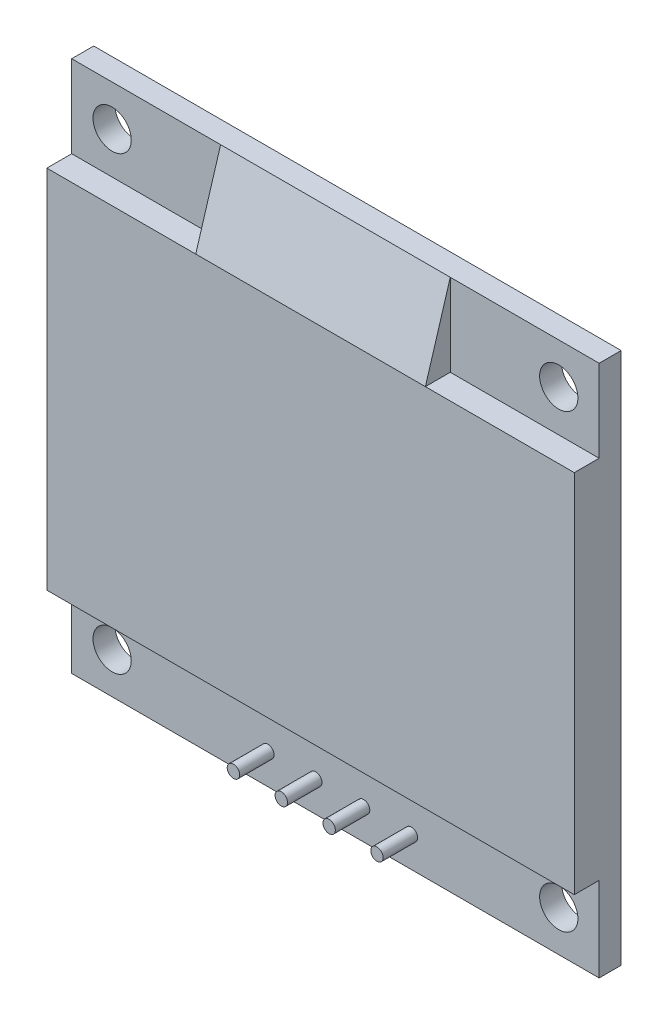
from build123d import *

# Parameters (mm, degrees)
ESQUISSE1_W                = 27.56
ESQUISSE1_H                = 27.82
ESQUISSE1_R                = 1
BOSS_EXTRU_1_DEPTH         = 1.15
ESQUISSE3_W                = 27.56
ESQUISSE3_H                = 19.1
BOSS_EXTRU_2_DEPTH         = 1.3
BOSS_EXTRU_3_START         = -10.1
ESQUISSE4_R                = 0.325
BOSS_EXTRU_3_DEPTH         = 11.9
R_P_TITION_LIN_AIRE1_COUNT = 4
R_P_TITION_LIN_AIRE1_PITCH = 2.5
ESQUISSE5_W                = 6.517687079
ESQUISSE5_H                = 1.70105674
BOSS_EXTRU_4_DEPTH         = 0.5
ESQUISSE6_W                = 10
ESQUISSE6_H                = 2.5
BOSS_EXTRU_5_DEPTH         = 2.3
BOSS_EXTRU_6_DEPTH         = 6


with BuildPart() as part:
    # Esquisse1 → Boss.-Extru.1 (new body)
    with BuildSketch(Plane.XY):
        Rectangle(ESQUISSE1_W, ESQUISSE1_H)
        with Locations((-11.668662175, 11.778743894)):
            Circle(ESQUISSE1_R, mode=Mode.SUBTRACT)
        with Locations((11.668662175, 11.778743894)):
            Circle(ESQUISSE1_R, mode=Mode.SUBTRACT)
        with Locations((-11.668662175, -11.778743894)):
            Circle(ESQUISSE1_R, mode=Mode.SUBTRACT)
        with Locations((11.668662175, -11.778743894)):
            Circle(ESQUISSE1_R, mode=Mode.SUBTRACT)
    extrude(amount=BOSS_EXTRU_1_DEPTH)

    # Esquisse3 → Boss.-Extru.2 (add)
    with BuildSketch(Plane.XY.offset(1.15)):
        with Locations((0, 0.06)):
            Rectangle(ESQUISSE3_W, ESQUISSE3_H)
    extrude(amount=BOSS_EXTRU_2_DEPTH)

    # Esquisse4 → Boss.-Extru.3 (add)
    with BuildSketch(Plane.XY.offset(1.15).offset(BOSS_EXTRU_3_START)):
        with Locations((-3.53, -12.31)):
            Circle(ESQUISSE4_R)
    boss_extru_3 = extrude(amount=BOSS_EXTRU_3_DEPTH)

    # Répétition linéaire1: Boss.-Extru.3 ×4
    with Locations(*[(i * R_P_TITION_LIN_AIRE1_PITCH, 0, 0) for i in range(1, R_P_TITION_LIN_AIRE1_COUNT)]):
        add(boss_extru_3)

    # Esquisse5 → Boss.-Extru.4 (add)
    with BuildSketch(Plane(origin=(0, 0, 0), x_dir=(-1, 0, 0), z_dir=(0, 0, -1))):
        with Locations((4.307160535, -7.158796769)):
            Rectangle(ESQUISSE5_W, ESQUISSE5_H)
    extrude(amount=BOSS_EXTRU_4_DEPTH)

    # Esquisse6 → Boss.-Extru.5 (add)
    with BuildSketch(Plane(origin=(0, 0, 0), x_dir=(-1, 0, 0), z_dir=(0, 0, -1))):
        with Locations((-0.22, -12.31)):
            Rectangle(ESQUISSE6_W, ESQUISSE6_H)
    extrude(amount=BOSS_EXTRU_5_DEPTH)

    # Esquisse7 → Boss.-Extru.6 (add, symmetric)
    with BuildSketch(Plane(origin=(0, 0, 0), x_dir=(0, 0, -1), z_dir=(1, 0, 0))):
        Polygon((-1.15, 13.91), (-2.45, 9.61), (-1.15, 9.61), align=None)
    extrude(amount=BOSS_EXTRU_6_DEPTH, both=True)


solid = part.part
